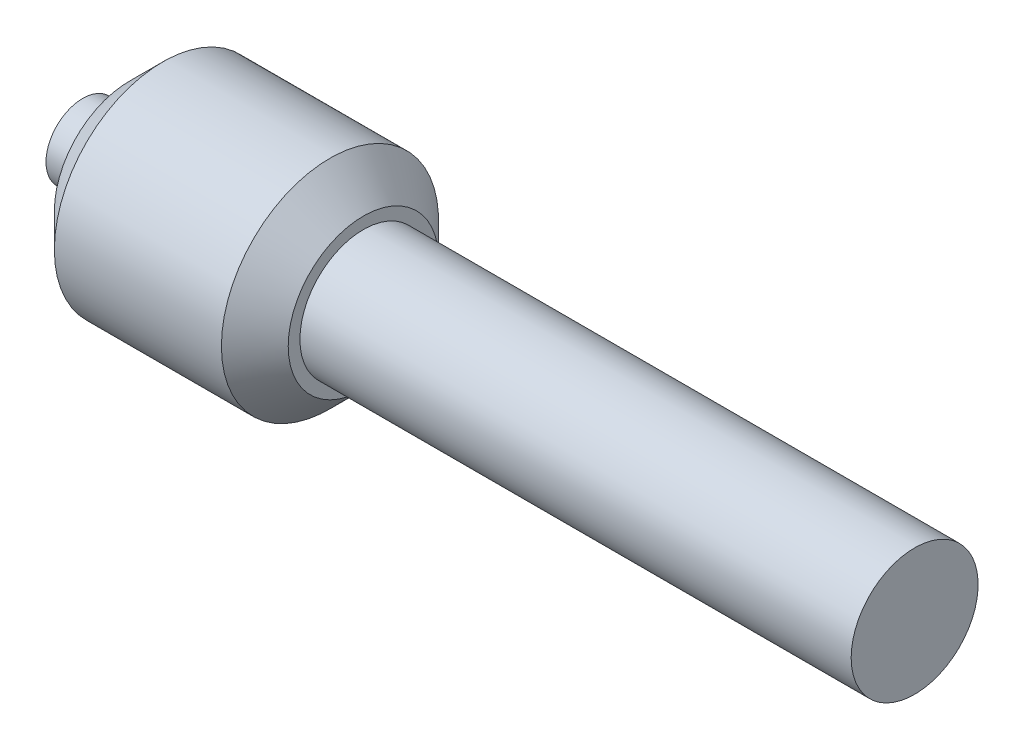
from build123d import *

# Parameters (mm, degrees)
M12X1_5_TAPPED_HOLE1_D           = 10.5
M12X1_5_TAPPED_HOLE1_DEPTH       = 24.84548175
M12X1_5_TAPPED_HOLE1_CSINK_D     = 12.05
M12X1_5_TAPPED_HOLE1_CSINK_ANGLE = 90
M12X1_5_TAPPED_HOLE1_TIP         = 3.15451825


with BuildPart() as part:
    # Sketch1 → Revolve1 (revolve)
    with BuildSketch(Plane.XY, mode=Mode.PRIVATE) as revolve1_sk:
        Polygon((0, 11), (14, 11), (14, 22.5), (24, 32.5), (74, 32.5), (84, 22.5), (84, 19), (249, 19), (249, 0), (0, 0), align=None)
    revolve(revolve1_sk.sketch.rotate(Axis((0, 0, 0), (1, 0, 0)), 90), axis=Axis((0, 0, 0), (1, 0, 0)))

    # M12x1.5 Tapped Hole1
    with Locations(Plane(origin=(0, 0, 0), x_dir=(0, 0, -1), z_dir=(-1, 0, 0))):
        with Locations((0, 0)):
            CounterSinkHole(M12X1_5_TAPPED_HOLE1_D / 2, M12X1_5_TAPPED_HOLE1_CSINK_D / 2, depth=M12X1_5_TAPPED_HOLE1_DEPTH, counter_sink_angle=M12X1_5_TAPPED_HOLE1_CSINK_ANGLE)
            with Locations((0, 0, -(M12X1_5_TAPPED_HOLE1_DEPTH + M12X1_5_TAPPED_HOLE1_TIP / 2))):  # 118° drill point
                Cone(0, M12X1_5_TAPPED_HOLE1_D / 2, M12X1_5_TAPPED_HOLE1_TIP, mode=Mode.SUBTRACT)


solid = part.part
